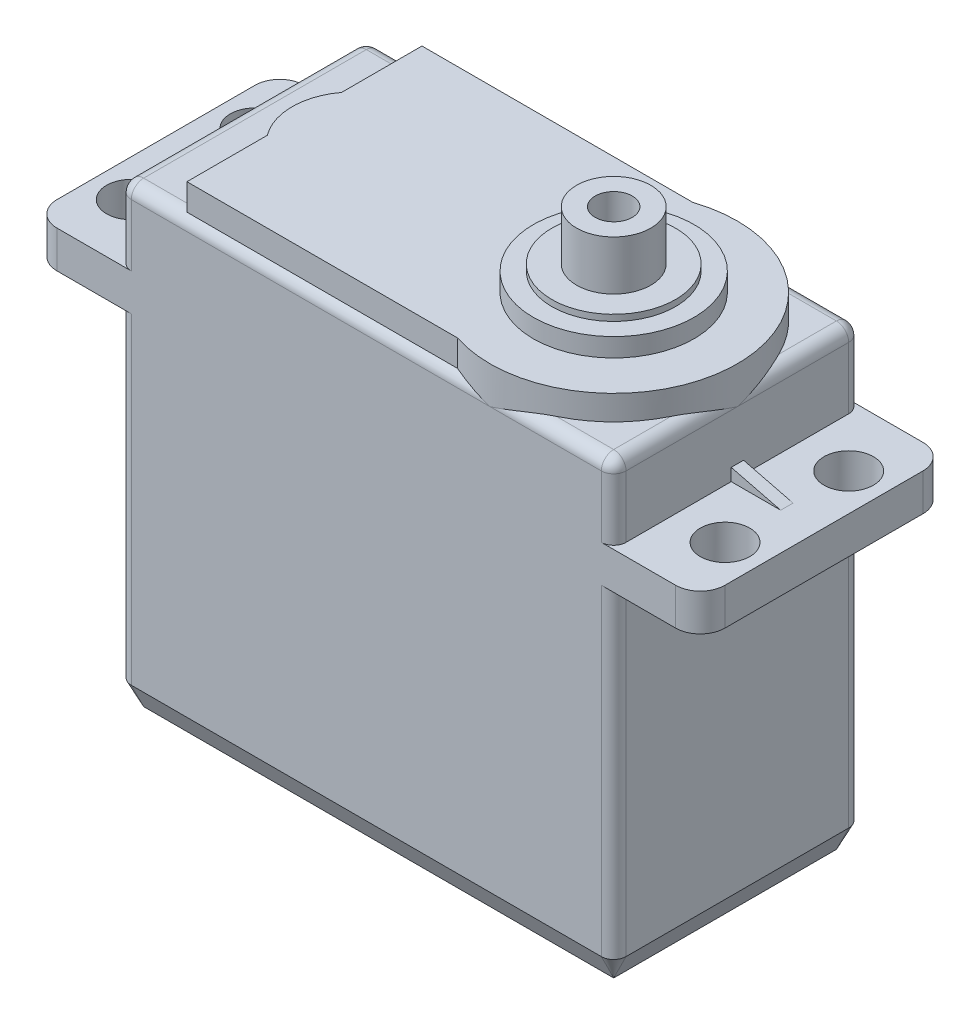
from build123d import *

# Parameters (mm, degrees)
SKETCH_1_W          = 54
SKETCH_1_H          = 20
EXTRUDE_1_DEPTH     = 37
SKETCH_2_W          = 67.922695334
SKETCH_2_H          = 39.407561178
SKETCH_2_W_2        = 40
SKETCH_2_H_2        = 20
CUT_EXTRUDE_1_DEPTH = 28
SKETCH_3_W          = 67.922695334
SKETCH_3_H          = 33.385731604
SKETCH_3_W_2        = 40
SKETCH_3_H_2        = 20
CUT_EXTRUDE_2_DEPTH = 6
FILLET_1_R          = 1
FILLET_2_R          = 2
CHAMFER_1_SIZE      = 1
CHAMFER_1_SIZE2     = 2
SKETCH_4_R          = 2
CUT_EXTRUDE_3_DEPTH = 30
RIB_1_REACH         = 48.883
SKETCH_5_WALL_W     = 99.888770984
SKETCH_5_WALL_H     = 1
EXTRUDE_START       = -1
EXTRUDE_4_DEPTH     = 3
SKETCH_9_R          = 6.5
EXTRUDE_5_DEPTH     = 2
CUT_EXTRUDE_START   = -0.5
SKETCH_10_R         = 6.5
SKETCH_10_R_2       = 5
CUT_EXTRUDE_4_DEPTH = 0.5
SKETCH_11_R         = 3
EXTRUDE_6_DEPTH     = 4
SKETCH_14_R         = 1.5
CUT_EXTRUDE_5_DEPTH = 4
SCALE_1_SCALE       = 0.5


with BuildPart() as part:
    # 草图1 → 凸台-拉伸1 (new body)
    with BuildSketch(Plane(origin=(0, 0, 0), x_dir=(1, 0, 0), z_dir=(0, 1, 0))):
        Rectangle(SKETCH_1_W, SKETCH_1_H)
    extrude(amount=EXTRUDE_1_DEPTH)

    # 草图2 → 切除-拉伸1 (cut)
    with BuildSketch(Plane.XZ):
        Rectangle(SKETCH_2_W, SKETCH_2_H)
        Rectangle(SKETCH_2_W_2, SKETCH_2_H_2, mode=Mode.SUBTRACT)
    extrude(amount=-CUT_EXTRUDE_1_DEPTH, mode=Mode.SUBTRACT)

    # 草图3 → 切除-拉伸2 (cut)
    with BuildSketch(Plane(origin=(0, 37, 0), x_dir=(1, 0, 0), z_dir=(0, 1, 0))):
        Rectangle(SKETCH_3_W, SKETCH_3_H)
        Rectangle(SKETCH_3_W_2, SKETCH_3_H_2, mode=Mode.SUBTRACT)
    extrude(amount=-CUT_EXTRUDE_2_DEPTH, mode=Mode.SUBTRACT)

    # 圆角1
    fillet_1_edges = [part.edges().sort_by_distance(p)[0] for p in [
        (20, 14, -10),
        (-20, 14, -10),
        (-20, 14, 10),
        (20, 14, 10),
        (0, 37, -10),
        (0, 37, 10),
        (20, 37, 0),
        (20, 34, 10),
        (-20, 34, 10),
        (-20, 37, 0),
        (-20, 34, -10),
        (20, 34, -10),
    ]]
    fillet(fillet_1_edges, radius=FILLET_1_R)

    # 圆角2
    fillet_2_edges = [part.edges().sort_by_distance(p)[0] for p in [
        (27, 29.5, 10),
        (-27, 29.5, 10),
        (-27, 29.5, -10),
        (27, 29.5, -10),
    ]]
    fillet(fillet_2_edges, radius=FILLET_2_R)

    # 倒角1
    chamfer_1_edges = [part.edges().sort_by_distance(p)[0] for p in [
        (0, 0, -10),
        (0, 0, 10),
        (-20, 0, 0),
        (20, 0, 0),
        (-19.707106781, 0, 9.707106781),
        (19.707106781, 0, 9.707106781),
        (19.707106781, 0, -9.707106781),
        (-19.707106781, 0, -9.707106781),
    ]]
    chamfer_1_side = [part.faces().sort_by_distance(p)[0] for p in [
        (0, 0, 0),
    ]]
    chamfer(chamfer_1_edges, length=CHAMFER_1_SIZE, length2=CHAMFER_1_SIZE2, reference=chamfer_1_side[0])

    # 草图4 → 切除-拉伸3 (cut)
    with BuildSketch(Plane(origin=(0, 37, 0), x_dir=(1, 0, 0), z_dir=(0, 1, 0))):
        with Locations(Location((-24, 5, 0), (0, 0, 270))):
            Circle(SKETCH_4_R)
        with Locations(Location((-24, -5, 0), (0, 0, 270))):
            Circle(SKETCH_4_R)
        with Locations(Location((24, -5, 0), (0, 0, 270))):
            Circle(SKETCH_4_R)
        with Locations(Location((24, 5, 0), (0, 0, 270))):
            Circle(SKETCH_4_R)
    extrude(amount=-CUT_EXTRUDE_3_DEPTH, mode=Mode.SUBTRACT)

    # 草图5 wall → 筋1 (add, up to next)
    with BuildSketch(Plane(origin=(-22, 31.5, 0), x_dir=(-0.970142500145, -0.242535625036, 0), z_dir=(0.242535625036, -0.970142500145, 0)), mode=Mode.PRIVATE) as rib_1_sk1:
        Rectangle(SKETCH_5_WALL_W, SKETCH_5_WALL_H)
    rib_1_tool1 = extrude(rib_1_sk1.sketch, amount=RIB_1_REACH, mode=Mode.PRIVATE) - part.part
    rib_1 = rib_1_tool1.solids().sort_by_distance((-22, 31.5, 0))[0]
    add(rib_1)

    # 镜向1: 筋1 across plane
    add(rib_1.mirror(Plane(origin=(0, 0, 0), x_dir=(0, 0, 1), z_dir=(1, 0, 0))))

    # 草图8 → 凸台-拉伸4 (add)
    with BuildSketch(Plane(origin=(0, 37, 0), x_dir=(1, 0, 0), z_dir=(0, 1, 0)).offset(EXTRUDE_START)):
        with BuildLine():
            Line((-15, 9.5), (6.877501001, 9.5))
            ThreePointArc((6.877501001, 9.5), (20, 0), (6.877501001, -9.5))
            Line((6.877501001, -9.5), (-15, -9.5))
            Line((-15, -9.5), (-15, -3))
            ThreePointArc((-15, -3), (-16, 0), (-15, 3))
            Line((-15, 3), (-15, 9.5))
        make_face()
    extrude(amount=EXTRUDE_4_DEPTH)

    # 草图9 → 凸台-拉伸5 (add)
    with BuildSketch(Plane(origin=(0, 39, 0), x_dir=(1, 0, 0), z_dir=(0, 1, 0))):
        with Locations(Location((10, 0, 0), (0, 0, 270))):
            Circle(SKETCH_9_R)
    extrude(amount=EXTRUDE_5_DEPTH)

    # 草图10 → 切除-拉伸4 (cut)
    with BuildSketch(Plane(origin=(0, 41, 0), x_dir=(1, 0, 0), z_dir=(0, 1, 0)).offset(CUT_EXTRUDE_START)):
        with Locations(Location((10, 0, 0), (0, 0, 270))):
            Circle(SKETCH_10_R)
        with Locations(Location((10, 0, 0), (0, 0, 270))):
            Circle(SKETCH_10_R_2, mode=Mode.SUBTRACT)
    extrude(amount=CUT_EXTRUDE_4_DEPTH, mode=Mode.SUBTRACT)

    # 草图11 → 凸台-拉伸6 (add)
    with BuildSketch(Plane(origin=(0, 41, 0), x_dir=(1, 0, 0), z_dir=(0, 1, 0))):
        with Locations(Location((10, 0, 0), (0, 0, 270))):
            Circle(SKETCH_11_R)
    extrude(amount=EXTRUDE_6_DEPTH)

    # 草图14 → 切除-拉伸5 (cut)
    with BuildSketch(Plane(origin=(0, 45, 0), x_dir=(1, 0, 0), z_dir=(0, 1, 0))):
        with Locations(Location((10, 0, 0), (0, 0, 270))):
            Circle(SKETCH_14_R)
    extrude(amount=-CUT_EXTRUDE_5_DEPTH, mode=Mode.SUBTRACT)


with BuildPart() as part_1:
    # 缩放比例1: scaled about (0.166200011, 19.802127708, 0)
    add(part.part.scale(SCALE_1_SCALE).moved(Location((0.083100006, 9.901063854, 0))))


solid = part_1.part
